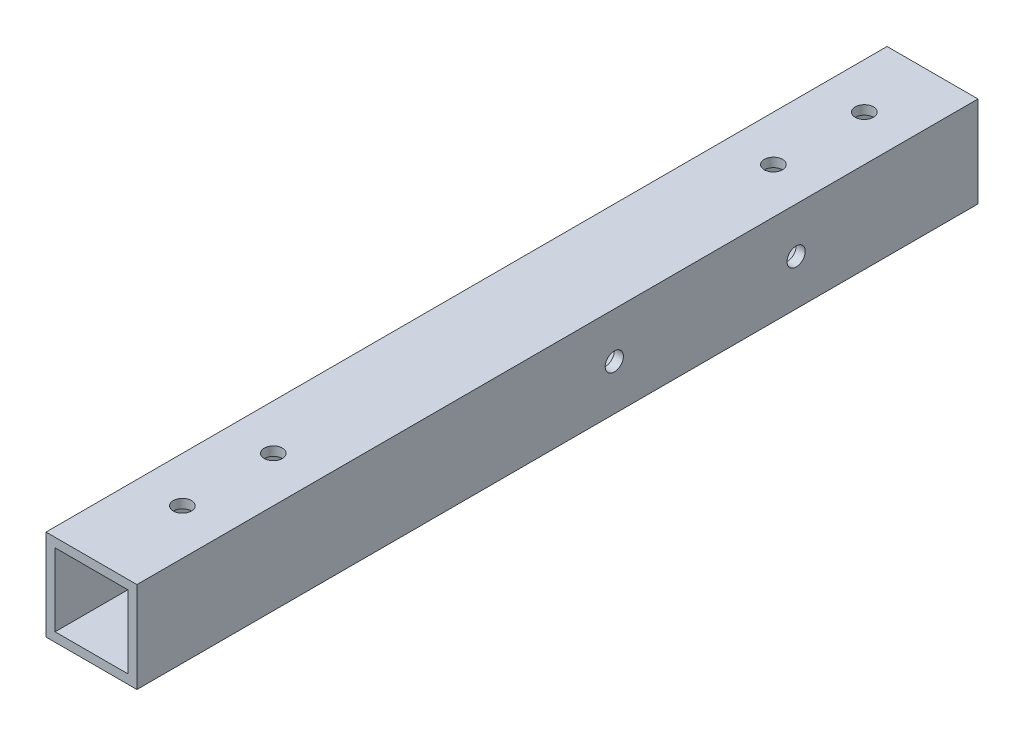
from build123d import *

# Parameters (mm, degrees)
SKETCH_1_W          = 20
SKETCH_1_H          = 20
SKETCH_1_W_2        = 16
SKETCH_1_H_2        = 16
EXTRUDE_1_DEPTH     = 185
SKETCH_2_R          = 2
CUT_EXTRUDE_1_DEPTH = 187.346451536
SKETCH_3_R          = 2
CUT_EXTRUDE_2_DEPTH = 187.346451536


with BuildPart() as part:
    # 草图1 → 凸台-拉伸1 (new body)
    with BuildSketch(Plane.XY):
        Rectangle(SKETCH_1_W, SKETCH_1_H)
        Rectangle(SKETCH_1_W_2, SKETCH_1_H_2, mode=Mode.SUBTRACT)
    extrude(amount=EXTRUDE_1_DEPTH)

    # 草图2 → 切除-拉伸1 (cut, through all)
    with BuildSketch(Plane(origin=(0, 10, 0), x_dir=(1, 0, 0), z_dir=(0, 1, 0))):
        with Locations(Location((0, -15, 0), (0, 0, 180))):
            Circle(SKETCH_2_R)
        with Locations(Location((0, -35, 0), (0, 0, 180))):
            Circle(SKETCH_2_R)
        with Locations(Location((0, -165, 0), (0, 0, 180))):
            Circle(SKETCH_2_R)
        with Locations(Location((0, -145, 0), (0, 0, 180))):
            Circle(SKETCH_2_R)
    extrude(amount=-CUT_EXTRUDE_1_DEPTH, mode=Mode.SUBTRACT)

    # 草图3 → 切除-拉伸2 (cut, through all)
    with BuildSketch(Plane.ZY.offset(10)):
        with Locations((40, 0)):
            Circle(SKETCH_3_R)
        with Locations((80, 0)):
            Circle(SKETCH_3_R)
    extrude(amount=-CUT_EXTRUDE_2_DEPTH, mode=Mode.SUBTRACT)


solid = part.part
